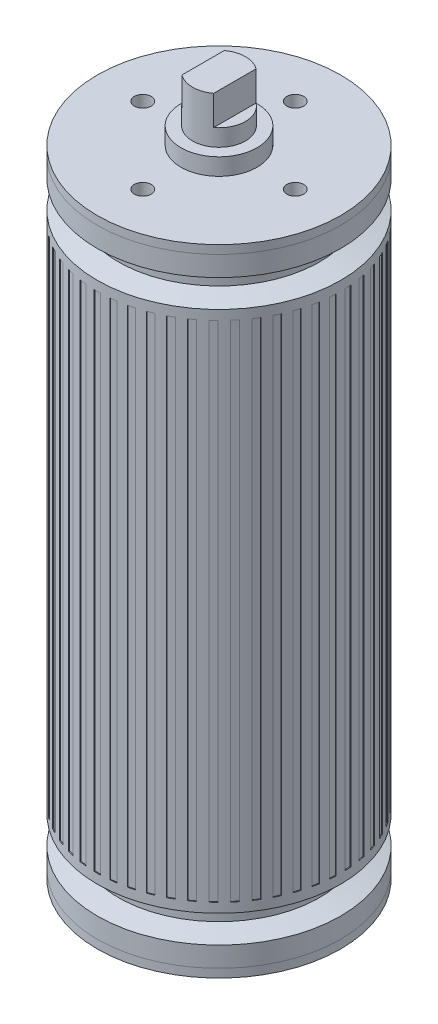
from build123d import *

# Parameters (mm, degrees)
SKETCH3_W          = 3
SKETCH3_H          = 0.8
CUT_EXTRUDE2_DEPTH = 238
CIRPATTERN1_COUNT  = 50
SKETCH4_R          = 4
CUT_EXTRUDE3_DEPTH = 50
SKETCH5_W          = 13.350817306
SKETCH5_H          = 14
SKETCH5_W_2        = 15.006672793
CUT_EXTRUDE4_DEPTH = 20


with BuildPart() as part:
    # Sketch1 → Revolve1 (revolve)
    with BuildSketch(Plane.XY, mode=Mode.PRIVATE) as revolve1_sk:
        Polygon((0, 360), (0, 0), (12.5, 0), (12.5, 22), (18, 22), (18, 30), (57.5, 30), (57.5, 43.5), (47.5, 46), (47.5, 54), (57.5, 56.5), (57.5, 303.5), (47.5, 306), (47.5, 314), (57.5, 316.5), (57.5, 330), (18, 330), (18, 338), (12.5, 338), (12.5, 360), align=None)
    revolve(revolve1_sk.sketch.rotate(Axis((0, 0, 0), (0, 1, 0)), 90), axis=Axis((0, 0, 0), (0, 1, 0)))

    # Sketch3 → Cut-Extrude2 (cut)
    with BuildSketch(Plane(origin=(0, 61, 0), x_dir=(1, 0, 0), z_dir=(0, 1, 0))):
        with Locations((0, 57.5)):
            Rectangle(SKETCH3_W, SKETCH3_H)
    cut_extrude2 = extrude(amount=CUT_EXTRUDE2_DEPTH, mode=Mode.SUBTRACT)

    # CirPattern1: Cut-Extrude2 ×50 about axis
    cirpattern1_axis = Axis((0, 0, 0), (0, 1, 0))
    for i in range(1, CIRPATTERN1_COUNT):
        add(cut_extrude2.rotate(cirpattern1_axis, i * 360 / CIRPATTERN1_COUNT), mode=Mode.SUBTRACT)

    # Sketch4 → Cut-Extrude3 (cut)
    with BuildSketch(Plane.XZ.offset(-30)):
        with Locations(Location((0, 36, 0), (0, 0, 270))):
            Circle(SKETCH4_R)
        with Locations(Location((36, 0, 0), (0, 0, 270))):
            Circle(SKETCH4_R)
        with Locations(Location((0, -36, 0), (0, 0, 270))):
            Circle(SKETCH4_R)
        with Locations(Location((-36, 0, 0), (0, 0, 270))):
            Circle(SKETCH4_R)
    cut_extrude3 = extrude(amount=-CUT_EXTRUDE3_DEPTH, mode=Mode.SUBTRACT)

    # Sketch5 → Cut-Extrude4 (cut, symmetric)
    with BuildSketch(Plane.XY):
        with Locations((14.175408653, 7)):
            Rectangle(SKETCH5_W, SKETCH5_H)
        with Locations((-15.003336396, 7)):
            Rectangle(SKETCH5_W_2, SKETCH5_H)
    cut_extrude4 = extrude(amount=CUT_EXTRUDE4_DEPTH, both=True, mode=Mode.SUBTRACT)

    # Mirror1: Cut-Extrude3, Cut-Extrude4 across plane
    add(cut_extrude3.mirror(Plane.ZX.offset(180)), mode=Mode.SUBTRACT)
    add(cut_extrude4.mirror(Plane.ZX.offset(180)), mode=Mode.SUBTRACT)


solid = part.part
